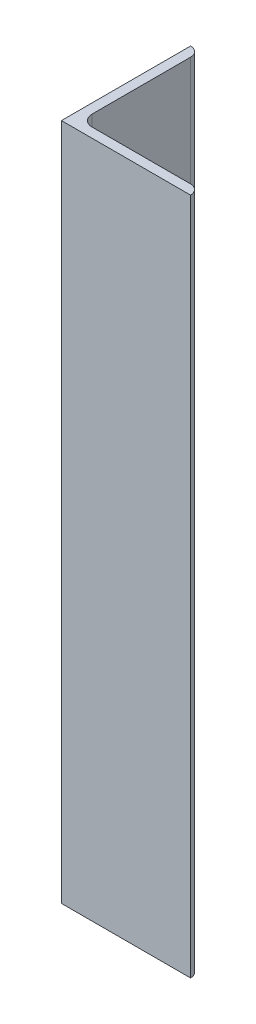
from build123d import *

# Parameters (mm, degrees)
IRON_V40X40X3_1_DEPTH = 210


with BuildPart() as part:
    # Sketch11 → Iron V40X40X3(1) (new body)
    with BuildSketch(Plane(origin=(0, 0, 0), x_dir=(1, 0, 0), z_dir=(0, 1, 0))):
        with BuildLine():
            Line((0, 0), (0, 40))
            ThreePointArc((0, 40), (2.121320344, 39.121320344), (3, 37))
            Line((3, 37), (3, 6.5))
            ThreePointArc((3, 6.5), (4.025126266, 4.025126266), (6.5, 3))
            Line((6.5, 3), (37, 3))
            ThreePointArc((37, 3), (39.121320344, 2.121320344), (40, 0))
            Line((40, 0), (0, 0))
        make_face()
    extrude(amount=IRON_V40X40X3_1_DEPTH)


solid = part.part
